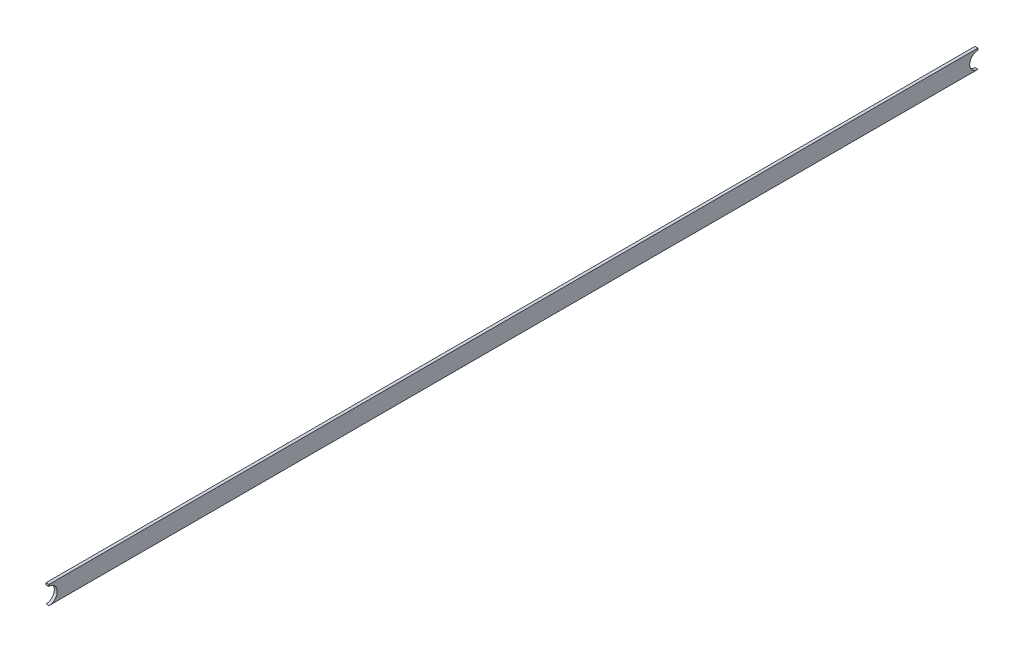
from build123d import *

# Parameters (mm, degrees)
SKETCH_1_W      = 8
SKETCH_1_H      = 50
EXTRUDE_1_DEPTH = 1237.5
EXTRUDE_2_DEPTH = 8


with BuildPart() as part:
    # Эскиз1 → Бобышка-Вытянуть1 (new, symmetric)
    with BuildSketch(Plane.XY):
        Rectangle(SKETCH_1_W, SKETCH_1_H)
    extrude(amount=EXTRUDE_1_DEPTH, both=True)

    # Эскиз2 → Бобышка-Вытянуть2 (add)
    with BuildSketch(Plane(origin=(4, 0, 0), x_dir=(0, 0, -1), z_dir=(1, 0, 0))):
        with BuildLine():
            Line((-1237.5, -2.500000274), (-1237.5, 25))
            Line((-1237.5, 25), (-1260, 25))
            Line((-1260, 25), (-1260, 20))
            ThreePointArc((-1260, 20), (-1244.090097326, 13.40990248), (-1237.5, -2.500000274))
        make_face()
        with BuildLine():
            Line((-1237.5, -25), (-1237.5, -2.500000274))
            ThreePointArc((-1237.5, -2.500000274), (-1244.09009752, -18.409902674), (-1260, -25))
            Line((-1260, -25), (-1237.5, -25))
        make_face()
    extrude_2 = extrude(amount=-EXTRUDE_2_DEPTH)

    # Зеркальное отражение1: Бобышка-Вытянуть2 across plane
    add(extrude_2.mirror(Plane.XY))


solid = part.part
